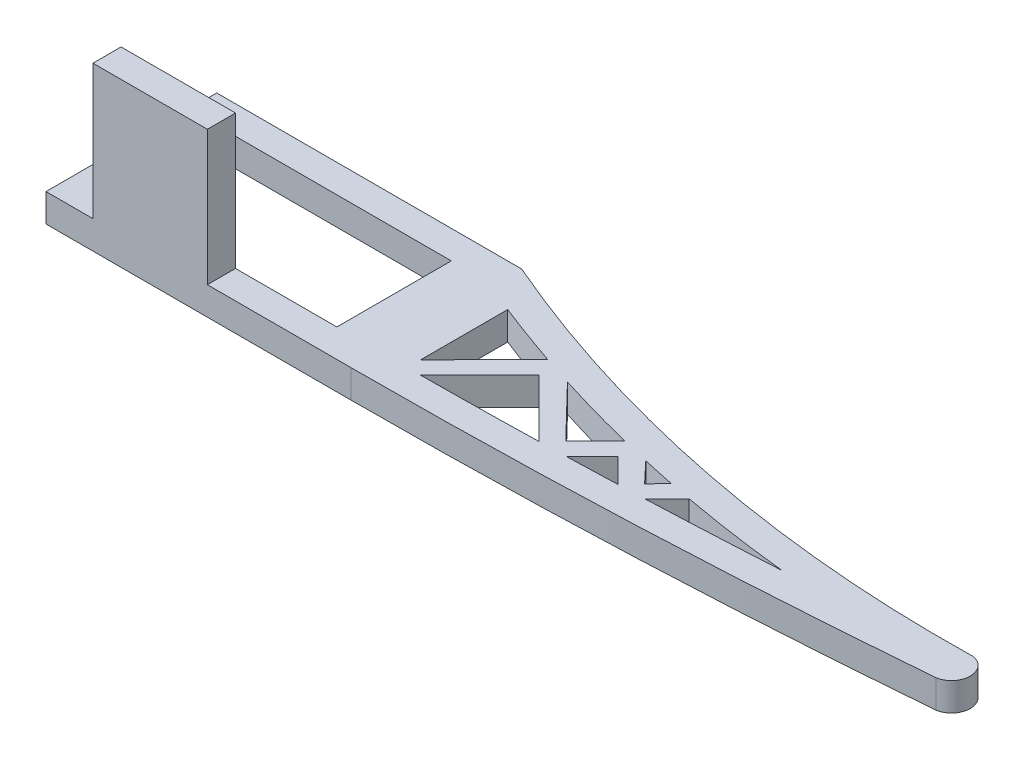
from build123d import *

# Parameters (mm, degrees)
SKETCH3_W           = 23
SKETCH3_H           = 12.2
BOSS_EXTRUDE1_DEPTH = 3
CUT_EXTRUDE1_DEPTH  = 79.334093387
SKETCH7_W           = 12.2
SKETCH7_H           = 3
BOSS_EXTRUDE2_DEPTH = 14.35


with BuildPart() as part:
    # Sketch3 → Boss-Extrude1 (new body)
    with BuildSketch(Plane(origin=(0, 0, 0), x_dir=(1, 0, 0), z_dir=(0, 1, 0))):
        with BuildLine():
            Line((-16.25, 9.2), (16.25, 9.2))
            ThreePointArc((16.25, 9.2), (45.532149663, 0.13158895), (76.073056463, -2.501542212))
            ThreePointArc((76.073056463, -2.501542212), (77.734099253, -4.472609946), (76.073056463, -6.443677679))
            ThreePointArc((76.073056463, -6.443677679), (46.188824578, -8.36062795), (16.25, -9))
            Line((16.25, -9), (-16.25, -9))
            Line((-16.25, -9), (-16.25, 9.2))
        make_face()
        with Locations((0.25, 0.1)):
            Rectangle(SKETCH3_W, SKETCH3_H, mode=Mode.SUBTRACT)
    extrude(amount=BOSS_EXTRUDE1_DEPTH)

    # Sketch5 → Cut-Extrude1 (cut, through all)
    with BuildSketch(Plane(origin=(0, 3, 0), x_dir=(1, 0, 0), z_dir=(0, 1, 0))):
        with BuildLine():
            Line((19.25, 4.714006378), (19.25, -4.579341889))
            Line((19.25, -4.579341889), (25.977749381, 2.242895118))
            ThreePointArc((25.977749381, 2.242895118), (22.598740451, 3.437246869), (19.25, 4.714006378))
        make_face()
        with BuildLine():
            Line((20.671769547, -5.985999467), (26.990590291, 0.332821278))
            Line((26.990590291, 0.332821278), (33.119603604, -5.796192035))
            ThreePointArc((33.119603604, -5.796192035), (26.896109589, -5.918837556), (20.671769547, -5.985999467))
        make_face()
        with BuildLine():
            Line((35.952850124, -5.721969404), (38.698754677, -2.976064852))
            Line((38.698754677, -2.976064852), (41.274144832, -5.551455007))
            ThreePointArc((41.274144832, -5.551455007), (38.613659992, -5.64178383), (35.952850124, -5.721969404))
        make_face()
        with BuildLine():
            Line((44.109524036, -5.444008267), (46.395047974, -3.086577857))
            ThreePointArc((46.395047974, -3.086577857), (52.157632807, -4.035426025), (57.95349503, -4.753533193))
            ThreePointArc((57.95349503, -4.753533193), (51.033222886, -5.133123327), (44.109524036, -5.444008267))
        make_face()
        with BuildLine():
            Line((29.11239722, 1.217185885), (34.499115549, -4.347276855))
            Line((34.499115549, -4.347276855), (37.58866149, -1.173111994))
            ThreePointArc((37.58866149, -1.173111994), (33.332539672, -0.041756487), (29.11239722, 1.217185885))
        make_face()
        with BuildLine():
            Line((40.562529295, -1.882957729), (42.638111064, -4.086994114))
            Line((42.638111064, -4.086994114), (44.022530764, -2.626821374))
            ThreePointArc((44.022530764, -2.626821374), (42.290280718, -2.265351983), (40.562529295, -1.882957729))
        make_face()
    extrude(amount=-CUT_EXTRUDE1_DEPTH, mode=Mode.SUBTRACT)

    # Sketch7 → Boss-Extrude2 (add)
    with BuildSketch(Plane(origin=(0, 3, 0), x_dir=(1, 0, 0), z_dir=(0, 1, 0))):
        with Locations((-5.15, -7.5)):
            Rectangle(SKETCH7_W, SKETCH7_H)
    extrude(amount=BOSS_EXTRUDE2_DEPTH)


solid = part.part
